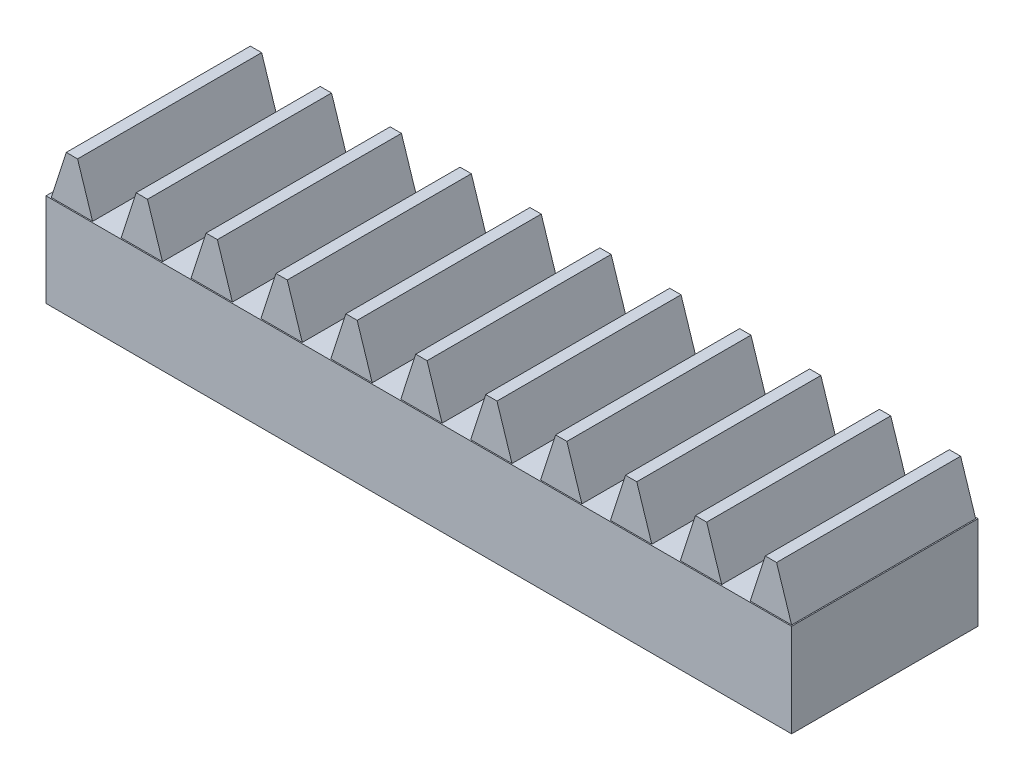
from build123d import *

# Parameters (mm, degrees)
SKETCH1_W           = 32
SKETCH1_H           = 8
BOSS_EXTRUDE1_DEPTH = 4
SKETCH2_W           = 31.9
SKETCH2_H           = 7.9
BOSS_EXTRUDE2_DEPTH = 2
SKETCH4_W           = 29
SKETCH4_H           = 5
CUT_EXTRUDE2_DEPTH  = 3
CUT_EXTRUDE3_DEPTH  = 10


with BuildPart() as part:
    # Sketch1 → Boss-Extrude1 (new body)
    with BuildSketch(Plane(origin=(0, 0, 0), x_dir=(1, 0, 0), z_dir=(0, 1, 0))):
        with Locations((64.774193548, -9.096774194)):
            Rectangle(SKETCH1_W, SKETCH1_H)
    extrude(amount=BOSS_EXTRUDE1_DEPTH)

    # Sketch2 → Boss-Extrude2 (add)
    with BuildSketch(Plane(origin=(0, 4, 0), x_dir=(1, 0, 0), z_dir=(0, 1, 0))):
        with Locations((64.774193548, -9.096774194)):
            Rectangle(SKETCH2_W, SKETCH2_H)
    extrude(amount=BOSS_EXTRUDE2_DEPTH)

    # Sketch4 → Cut-Extrude2 (cut)
    with BuildSketch(Plane.XZ):
        with Locations((64.774193548, 9.096774194)):
            Rectangle(SKETCH4_W, SKETCH4_H)
    extrude(amount=-CUT_EXTRUDE2_DEPTH, mode=Mode.SUBTRACT)

    # Sketch3 → Cut-Extrude3 (cut)
    with BuildSketch(Plane(origin=(0, 0, 5.146774194), x_dir=(-1, 0, 0), z_dir=(0, 0, -1))):
        Polygon((-77.724193548, 4), (-77.079193548, 6), (-79.594193548, 6), (-78.949193548, 4), align=None)
        Polygon((-82.594193548, 6), (-81.949193548, 4), (-80.724193548, 4), (-80.079193548, 6), align=None)
        Polygon((-74.724193548, 4), (-74.079193548, 6), (-76.594193548, 6), (-75.949193548, 4), align=None)
        Polygon((-71.724193548, 4), (-71.079193548, 6), (-73.594193548, 6), (-72.949193548, 4), align=None)
        Polygon((-68.724193548, 4), (-68.079193548, 6), (-70.594193548, 6), (-69.949193548, 4), align=None)
        Polygon((-65.724193548, 4), (-65.079193548, 6), (-67.594193548, 6), (-66.949193548, 4), align=None)
        Polygon((-62.724193548, 4), (-62.079193548, 6), (-64.594193548, 6), (-63.949193548, 4), align=None)
        Polygon((-59.724193548, 4), (-59.079193548, 6), (-61.594193548, 6), (-60.949193548, 4), align=None)
        Polygon((-56.724193548, 4), (-56.079193548, 6), (-58.594193548, 6), (-57.949193548, 4), align=None)
        Polygon((-53.724193548, 4), (-53.079193548, 6), (-55.594193548, 6), (-54.949193548, 4), align=None)
        Polygon((-50.724193548, 4), (-50.079193548, 6), (-52.594193548, 6), (-51.949193548, 4), align=None)
        Polygon((-47.724193548, 4), (-47.079193548, 6), (-49.594193548, 6), (-48.949193548, 4), align=None)
        Polygon((-44.724193548, 4), (-44.079193548, 6), (-46.594193548, 6), (-45.949193548, 4), align=None)
    extrude(amount=-CUT_EXTRUDE3_DEPTH, mode=Mode.SUBTRACT)


solid = part.part
